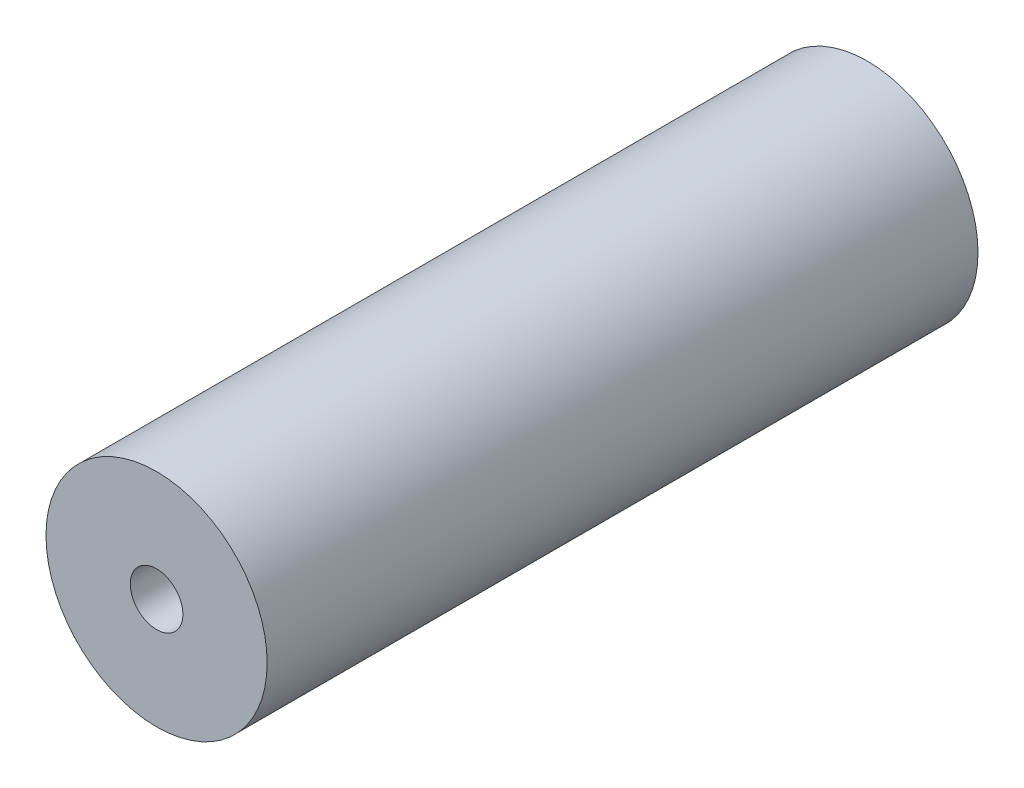
from build123d import *

# Parameters (mm, degrees)
BOSS_EXTRUDE1_DEPTH      = 67.5
BOSS_EXTRUDE1_DEPTH_BACK = 67.5
SKETCH2_R                = 21
SKETCH3_R                = 5
CUT_EXTRUDE1_DEPTH       = 135
SKETCH4_R                = 2
CUT_EXTRUDE2_DEPTH       = 9


with BuildPart() as part:
    # Sketch2 → Boss-Extrude1 (new, two sides: drawn at the far end of the back side and taken through both)
    with BuildSketch(Plane.XY.offset(-BOSS_EXTRUDE1_DEPTH_BACK)):
        Circle(SKETCH2_R)
    extrude(amount=BOSS_EXTRUDE1_DEPTH + BOSS_EXTRUDE1_DEPTH_BACK)

    # Sketch3 → Cut-Extrude1 (cut)
    with BuildSketch(Plane.XY.offset(67.5)):
        Circle(SKETCH3_R)
    extrude(amount=-CUT_EXTRUDE1_DEPTH, mode=Mode.SUBTRACT)

    # Sketch4 → Cut-Extrude2 (cut)
    with BuildSketch(Plane(origin=(0, 0, -67.5), x_dir=(-1, 0, 0), z_dir=(0, 0, -1))):
        with Locations((0, 17.5)):
            Circle(SKETCH4_R)
        with Locations((17.5, 0)):
            Circle(SKETCH4_R)
        with Locations((0, -17.5)):
            Circle(SKETCH4_R)
        with Locations((-17.5, 0)):
            Circle(SKETCH4_R)
    extrude(amount=-CUT_EXTRUDE2_DEPTH, mode=Mode.SUBTRACT)


solid = part.part
